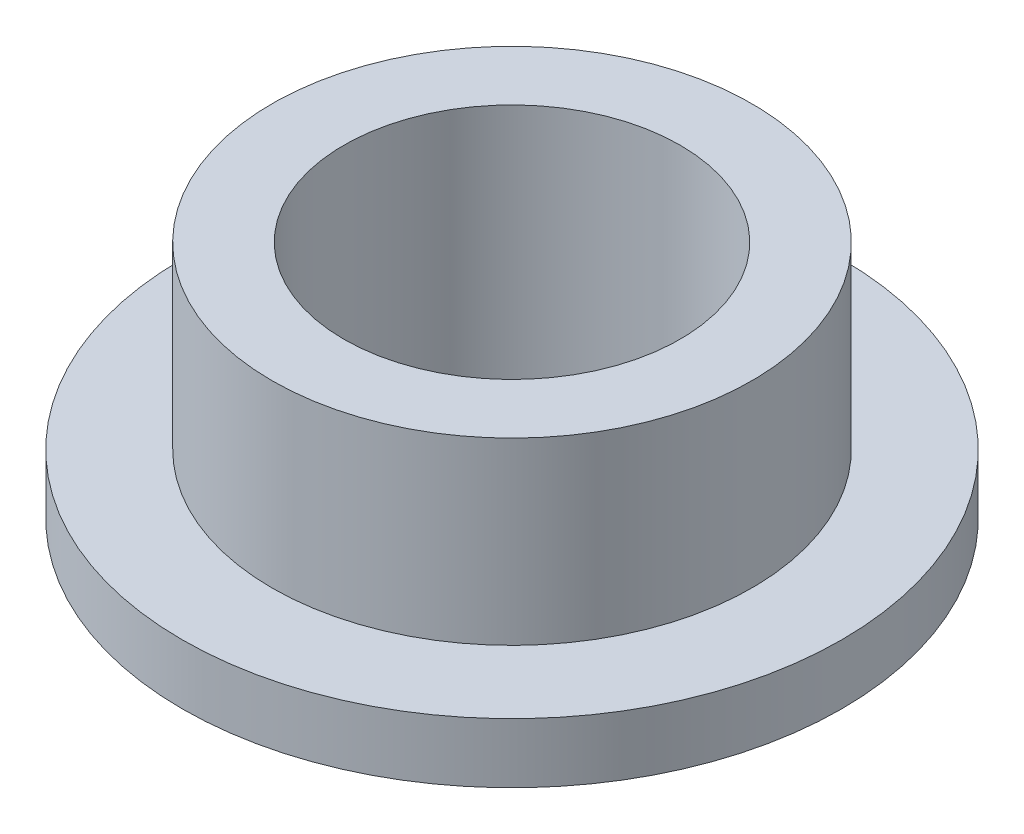
from build123d import *

# Parameters (mm, degrees)
SKETCH1_R           = 20.05
SKETCH1_R_2         = 14.05
BOSS_EXTRUDE1_DEPTH = 15
BOSS_EXTRUDE2_START = -5
SKETCH2_R           = 27.55
SKETCH2_R_2         = 14.05
BOSS_EXTRUDE2_DEPTH = 5


with BuildPart() as part:
    # Sketch1 → Boss-Extrude1 (new body)
    with BuildSketch(Plane(origin=(0, 0, 0), x_dir=(1, 0, 0), z_dir=(0, 1, 0))):
        with Locations(Location((0, 0, 0), (0, 0, 270))):
            Circle(SKETCH1_R)
        with Locations(Location((0, 0, 0), (0, 0, 270))):
            Circle(SKETCH1_R_2, mode=Mode.SUBTRACT)
    extrude(amount=BOSS_EXTRUDE1_DEPTH)

    # Sketch2 → Boss-Extrude2 (add)
    with BuildSketch(Plane(origin=(0, 0, 0), x_dir=(1, 0, 0), z_dir=(0, 1, 0)).offset(BOSS_EXTRUDE2_START)):
        with Locations(Location((0, 0, 0), (0, 0, 270))):
            Circle(SKETCH2_R)
        with Locations(Location((0, 0, 0), (0, 0, 270))):
            Circle(SKETCH2_R_2, mode=Mode.SUBTRACT)
    extrude(amount=BOSS_EXTRUDE2_DEPTH)


solid = part.part
